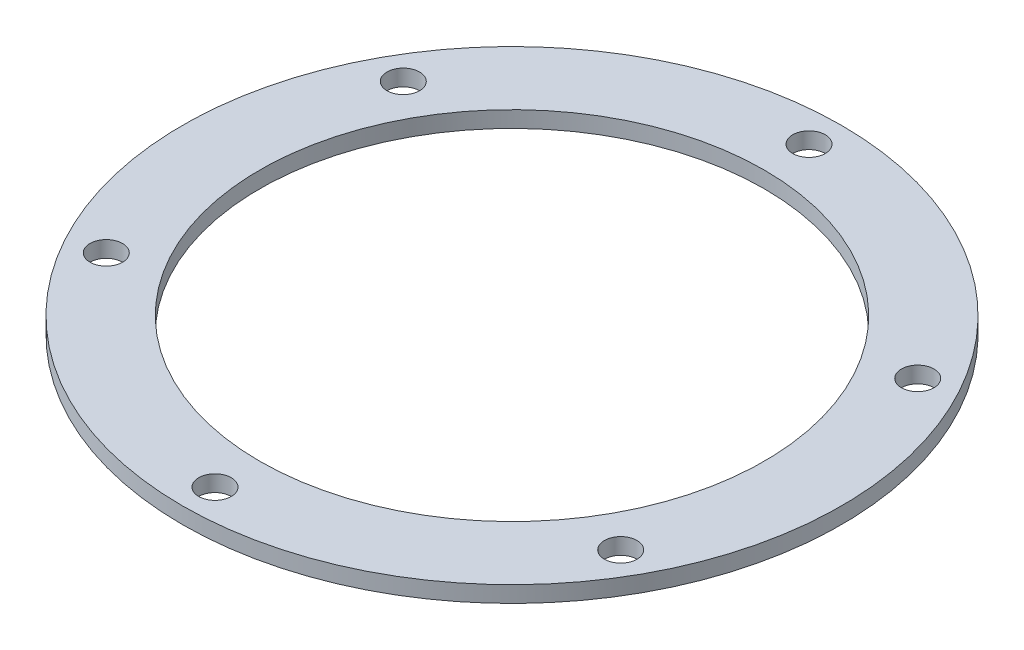
from build123d import *

# Parameters (mm, degrees)
SKETCH1_R           = 40.5
SKETCH1_R_2         = 31
SKETCH1_R_3         = 2
BOSS_EXTRUDE1_DEPTH = 1


with BuildPart() as part:
    # Sketch1 → Boss-Extrude1 (new, symmetric)
    with BuildSketch(Plane(origin=(0, 0, 0), x_dir=(1, 0, 0), z_dir=(0, 1, 0))):
        with Locations(Location((0, 0, 0), (0, 0, 270))):
            Circle(SKETCH1_R)
        with Locations(Location((0, 0, 0), (0, 0, 270))):
            Circle(SKETCH1_R_2, mode=Mode.SUBTRACT)
        with Locations(Location((0, 36.5, 0), (0, 0, 270))):
            Circle(SKETCH1_R_3, mode=Mode.SUBTRACT)
        with Locations(Location((31.609927238, 18.25, 0), (0, 0, 270))):
            Circle(SKETCH1_R_3, mode=Mode.SUBTRACT)
        with Locations(Location((31.609927238, -18.25, 0), (0, 0, 270))):
            Circle(SKETCH1_R_3, mode=Mode.SUBTRACT)
        with Locations(Location((0, -36.5, 0), (0, 0, 270))):
            Circle(SKETCH1_R_3, mode=Mode.SUBTRACT)
        with Locations(Location((-31.609927238, -18.25, 0), (0, 0, 270))):
            Circle(SKETCH1_R_3, mode=Mode.SUBTRACT)
        with Locations(Location((-31.609927238, 18.25, 0), (0, 0, 270))):
            Circle(SKETCH1_R_3, mode=Mode.SUBTRACT)
    extrude(amount=BOSS_EXTRUDE1_DEPTH, both=True)


solid = part.part
